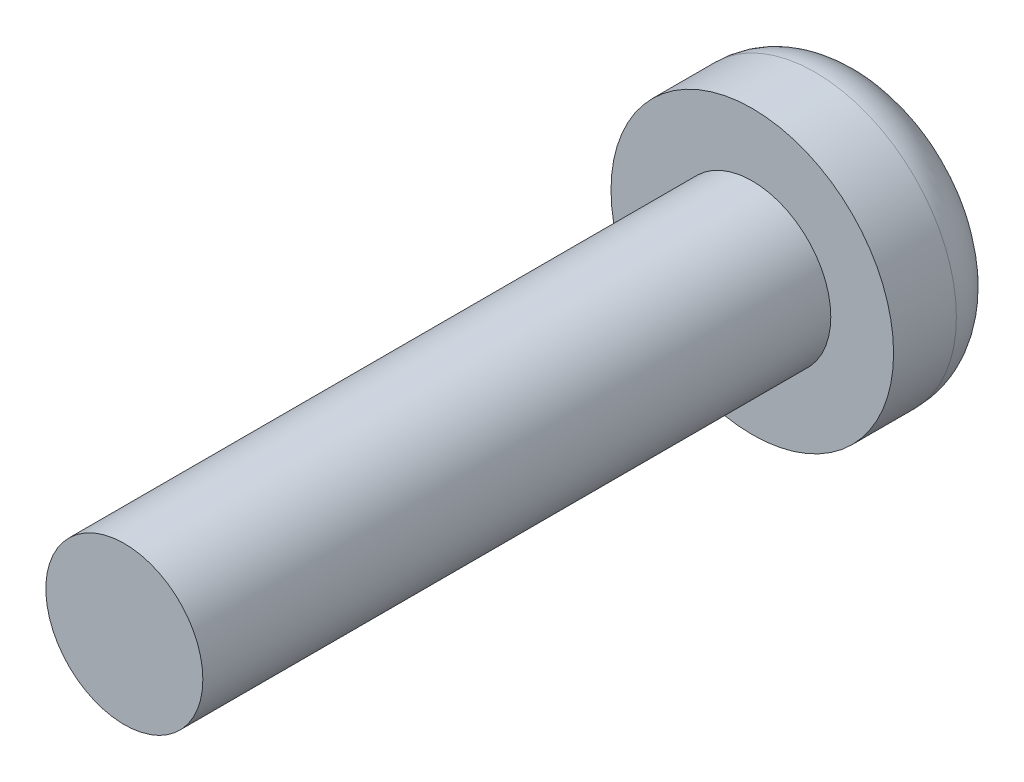
from build123d import *

# Parameters (mm, degrees)
SKETCH_1_R      = 1.5
EXTRUDE_1_DEPTH = 12
SKETCH_2_R      = 2.7
EXTRUDE_2_DEPTH = 2.2
FILLET_1_R      = 1


with BuildPart() as part:
    # 草图1 → 凸台-拉伸1 (new body)
    with BuildSketch(Plane.XY):
        Circle(SKETCH_1_R)
    extrude(amount=EXTRUDE_1_DEPTH)

    # 草图2 → 凸台-拉伸2 (add)
    with BuildSketch(Plane(origin=(0, 0, 0), x_dir=(-1, 0, 0), z_dir=(0, 0, -1))):
        Circle(SKETCH_2_R)
    extrude(amount=EXTRUDE_2_DEPTH)

    # 圆角1
    fillet_1_edges = [part.edges().sort_by_distance(p)[0] for p in [
        (2.7, 0, -2.2),
    ]]
    fillet(fillet_1_edges, radius=FILLET_1_R)


solid = part.part
